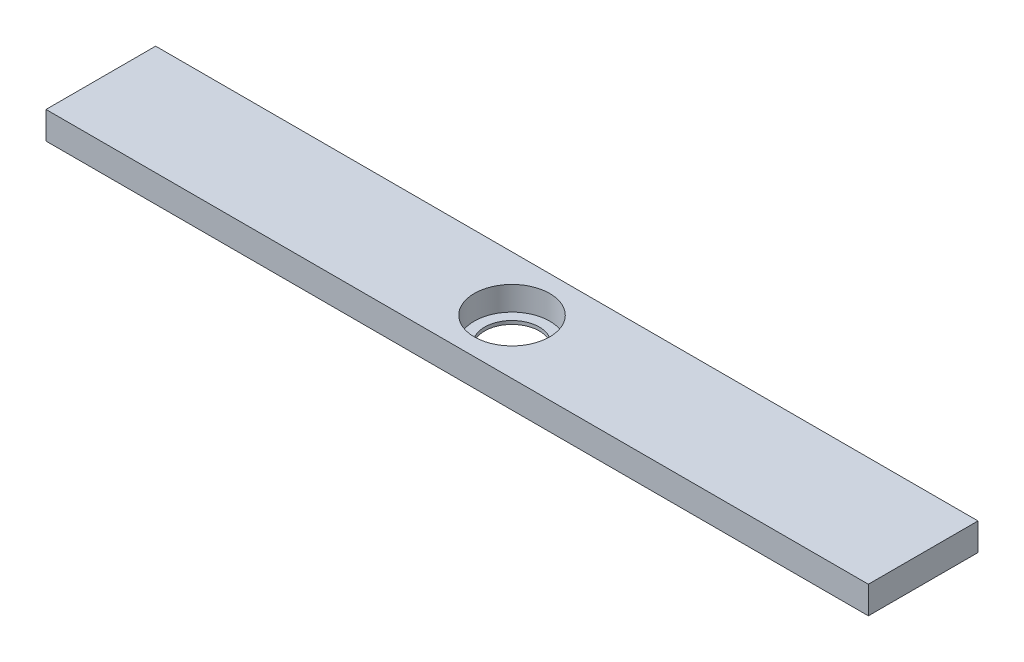
from build123d import *

# Parameters (mm, degrees)
SKETCH1_W           = 381
SKETCH1_H           = 50.8
BOSS_EXTRUDE1_DEPTH = 12.7
SKETCH2_R           = 17.4625
CUT_EXTRUDE1_DEPTH  = 11.1125
SKETCH3_R           = 12.7
CUT_EXTRUDE2_DEPTH  = 193.506876906


with BuildPart() as part:
    # Sketch1 → Boss-Extrude1 (new body)
    with BuildSketch(Plane(origin=(0, 0, 0), x_dir=(1, 0, 0), z_dir=(0, 1, 0))):
        Rectangle(SKETCH1_W, SKETCH1_H)
    extrude(amount=BOSS_EXTRUDE1_DEPTH)

    # Sketch2 → Cut-Extrude1 (cut)
    with BuildSketch(Plane(origin=(0, 12.7, 0), x_dir=(1, 0, 0), z_dir=(0, 1, 0))):
        with Locations(Location((0, 0, 0), (0, 0, 270))):
            Circle(SKETCH2_R)
    extrude(amount=-CUT_EXTRUDE1_DEPTH, mode=Mode.SUBTRACT)

    # Sketch3 → Cut-Extrude2 (cut, through all)
    with BuildSketch(Plane(origin=(0, 1.5875, 0), x_dir=(1, 0, 0), z_dir=(0, 1, 0))):
        with Locations(Location((0, 0, 0), (0, 0, 270))):
            Circle(SKETCH3_R)
    extrude(amount=-CUT_EXTRUDE2_DEPTH, mode=Mode.SUBTRACT)


solid = part.part
